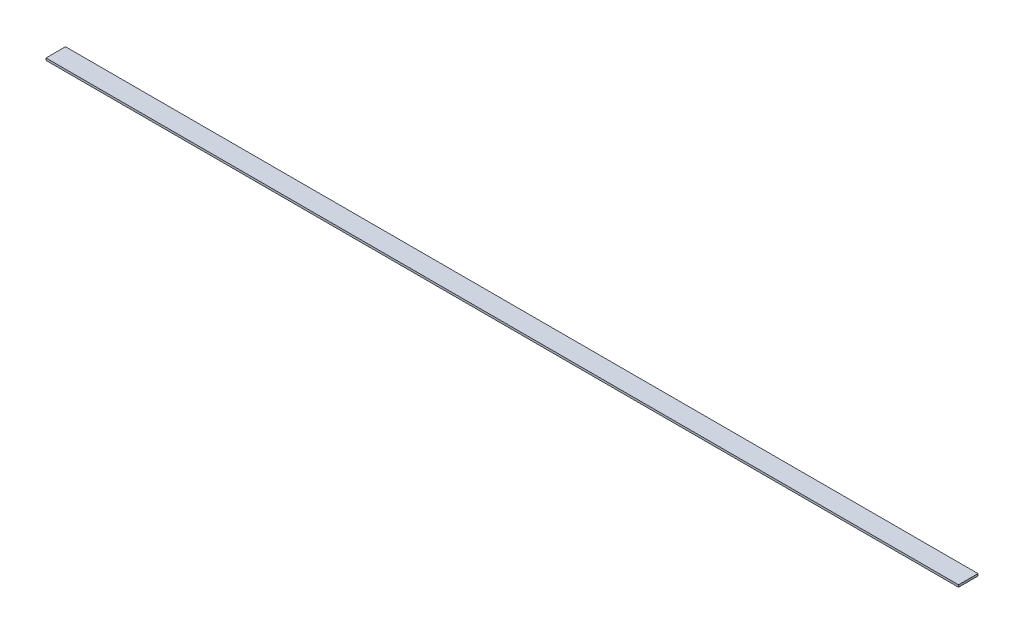
from build123d import *

# Parameters (mm, degrees)
SKETCH1_W           = 1055
SKETCH1_H           = 22.5
BOSS_EXTRUDE1_DEPTH = 2.5


with BuildPart() as part:
    # Sketch1 → Boss-Extrude1 (new body)
    with BuildSketch(Plane(origin=(0, 0, 0), x_dir=(1, 0, 0), z_dir=(0, 1, 0))):
        Rectangle(SKETCH1_W, SKETCH1_H)
    extrude(amount=BOSS_EXTRUDE1_DEPTH)


solid = part.part
